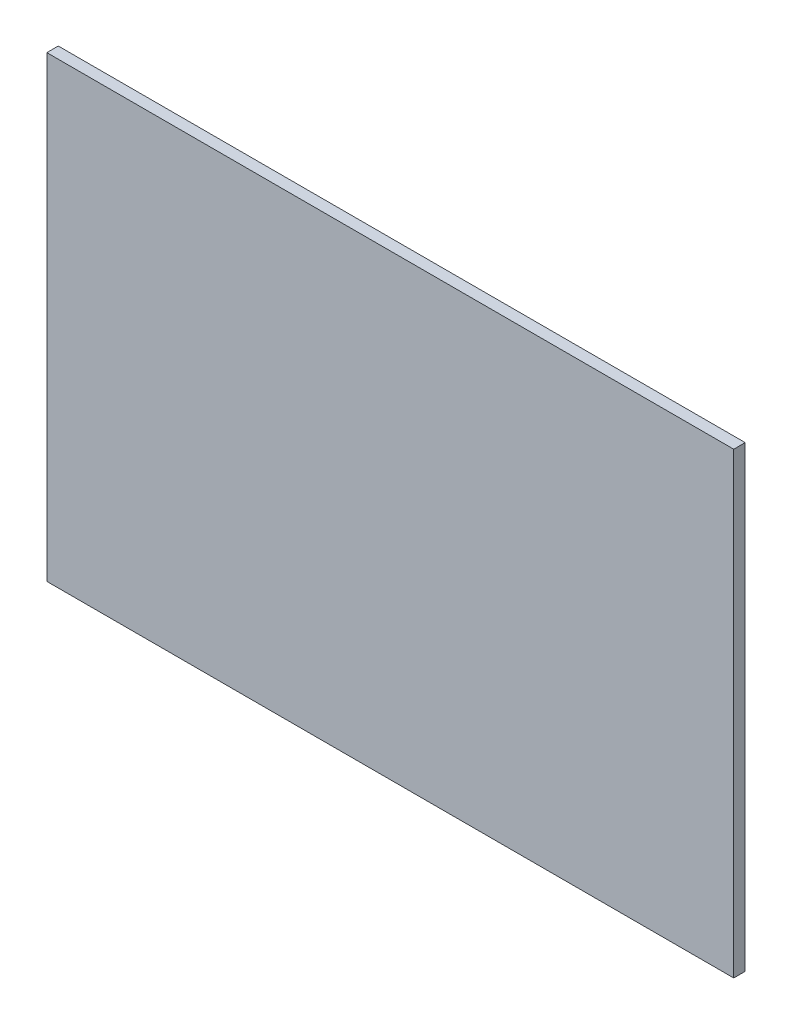
from build123d import *

# Parameters (mm, degrees)
SKETCH_1_W      = 600
SKETCH_1_H      = 400
EXTRUDE_1_DEPTH = 10


with BuildPart() as part:
    # 草图1 → 凸台-拉伸1 (new body)
    with BuildSketch(Plane.XY):
        with Locations((300, 200)):
            Rectangle(SKETCH_1_W, SKETCH_1_H)
    extrude(amount=EXTRUDE_1_DEPTH)


solid = part.part
